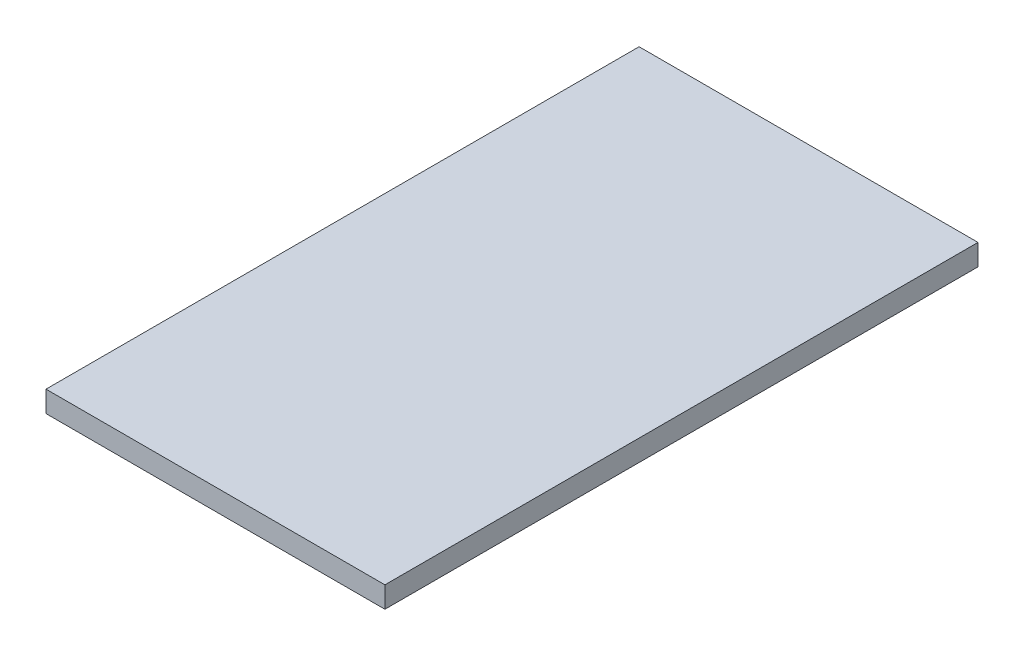
from build123d import *

# Parameters (mm, degrees)
SKETCH1_W           = 304.8
SKETCH1_H           = 533.4
BOSS_EXTRUDE1_DEPTH = 19.05


with BuildPart() as part:
    # Sketch1 → Boss-Extrude1 (new body)
    with BuildSketch(Plane(origin=(0, 0, 0), x_dir=(1, 0, 0), z_dir=(0, 1, 0))):
        with Locations((152.4, 266.7)):
            Rectangle(SKETCH1_W, SKETCH1_H)
    extrude(amount=BOSS_EXTRUDE1_DEPTH)


solid = part.part
